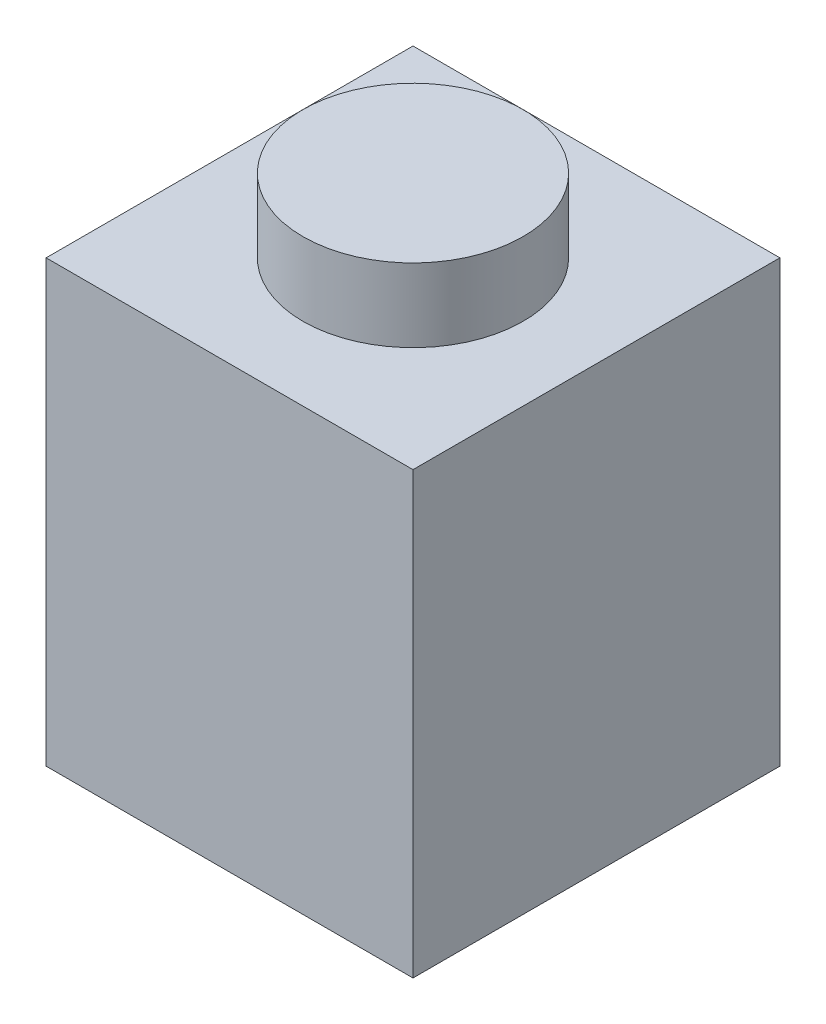
from build123d import *

# Parameters (mm, degrees)
SKETCH1_W           = 8
SKETCH1_H           = 8
BOSS_EXTRUDE1_DEPTH = 9.6
SKETCH2_R           = 2.4
BOSS_EXTRUDE2_DEPTH = 1.6
SHELL1_T            = -1.6


with BuildPart() as part:
    # Sketch1 → Boss-Extrude1 (new body)
    with BuildSketch(Plane(origin=(0, 0, 0), x_dir=(1, 0, 0), z_dir=(0, 1, 0))):
        with Locations((4, 4)):
            Rectangle(SKETCH1_W, SKETCH1_H)
    extrude(amount=BOSS_EXTRUDE1_DEPTH)

    # Sketch2 → Boss-Extrude2 (add)
    with BuildSketch(Plane(origin=(0, 9.6, 0), x_dir=(1, 0, 0), z_dir=(0, 1, 0))):
        with Locations(Location((4, 4, 0), (0, 0, 270))):
            Circle(SKETCH2_R)
    extrude(amount=BOSS_EXTRUDE2_DEPTH)

    # Shell1
    shell1_openings = [part.faces().sort_by_distance(p)[0] for p in [
        (4, 0, -4),
    ]]
    offset(amount=SHELL1_T, openings=shell1_openings, kind=Kind.INTERSECTION)


solid = part.part
